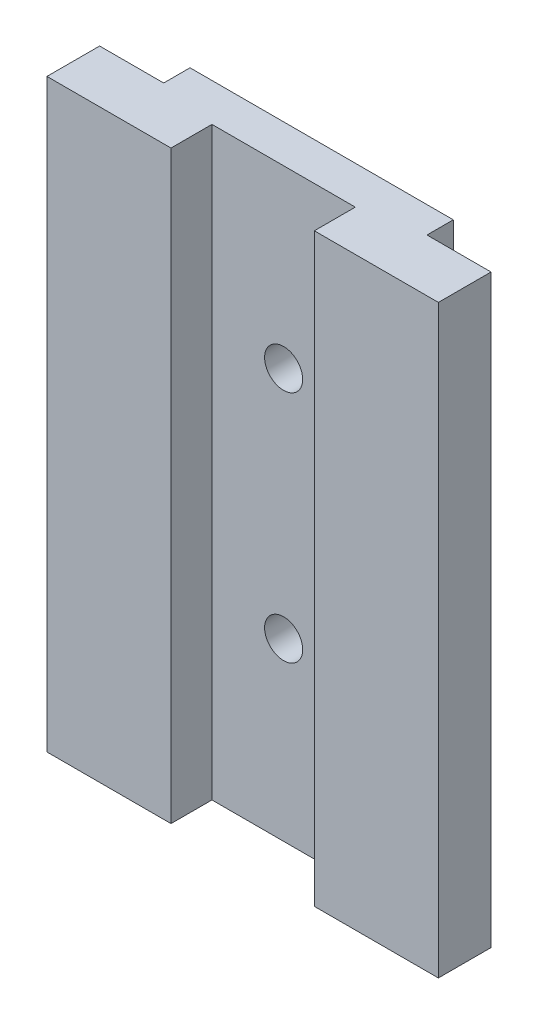
from build123d import *

# Parameters (mm, degrees)
BOSS_EXTRUDE1_DEPTH = 50.8
SKETCH2_R           = 2.921
BOSS_EXTRUDE2_DEPTH = 4.445
FILLET1_R           = 0.254
SKETCH3_R           = 1.651
CUT_EXTRUDE1_DEPTH  = 55.746198624
SKETCH4_R           = 2.921
BOSS_EXTRUDE3_DEPTH = 4.445
FILLET2_R           = 0.254
SKETCH5_R           = 1.651
CUT_EXTRUDE2_DEPTH  = 55.746198624


with BuildPart() as part:
    # Sketch1 → Boss-Extrude1 (new body)
    with BuildSketch(Plane(origin=(0, 0, 0), x_dir=(1, 0, 0), z_dir=(0, 1, 0))):
        Polygon((0, 0), (11.43, 0), (11.43, -2.286), (16.9926, -2.286), (16.9926, -6.858), (6.223, -6.858), (6.223, -3.302), (-6.223, -3.302), (-6.223, -6.858), (-16.9926, -6.858), (-16.9926, -2.286), (-11.43, -2.286), (-11.43, 0), align=None)
    extrude(amount=BOSS_EXTRUDE1_DEPTH)

    # Sketch2 → Boss-Extrude2 (add)
    with BuildSketch(Plane(origin=(0, 0, 0), x_dir=(-1, 0, 0), z_dir=(0, 0, -1))):
        with Locations(Location((0, 15.24, 0), (0, 0, 180))):
            Circle(SKETCH2_R)
    extrude(amount=BOSS_EXTRUDE2_DEPTH)

    # Fillet1
    fillet1_edges = [part.edges().sort_by_distance(p)[0] for p in [
        (-2.921, 15.24, -4.445),
    ]]
    fillet(fillet1_edges, radius=FILLET1_R)

    # Sketch3 → Cut-Extrude1 (cut, through all)
    with BuildSketch(Plane(origin=(0, 0, -4.445), x_dir=(-1, 0, 0), z_dir=(0, 0, -1))):
        with Locations((0, 15.24)):
            Circle(SKETCH3_R)
    extrude(amount=-CUT_EXTRUDE1_DEPTH, mode=Mode.SUBTRACT)

    # Sketch4 → Boss-Extrude3 (add)
    with BuildSketch(Plane(origin=(0, 0, 0), x_dir=(-1, 0, 0), z_dir=(0, 0, -1))):
        with Locations(Location((0, 35.56, 0), (0, 0, 180))):
            Circle(SKETCH4_R)
    extrude(amount=BOSS_EXTRUDE3_DEPTH)

    # Fillet2
    fillet2_edges = [part.edges().sort_by_distance(p)[0] for p in [
        (-2.921, 35.56, -4.445),
    ]]
    fillet(fillet2_edges, radius=FILLET2_R)

    # Sketch5 → Cut-Extrude2 (cut, through all)
    with BuildSketch(Plane(origin=(0, 0, -4.445), x_dir=(-1, 0, 0), z_dir=(0, 0, -1))):
        with Locations((0, 35.56)):
            Circle(SKETCH5_R)
    extrude(amount=-CUT_EXTRUDE2_DEPTH, mode=Mode.SUBTRACT)


solid = part.part
